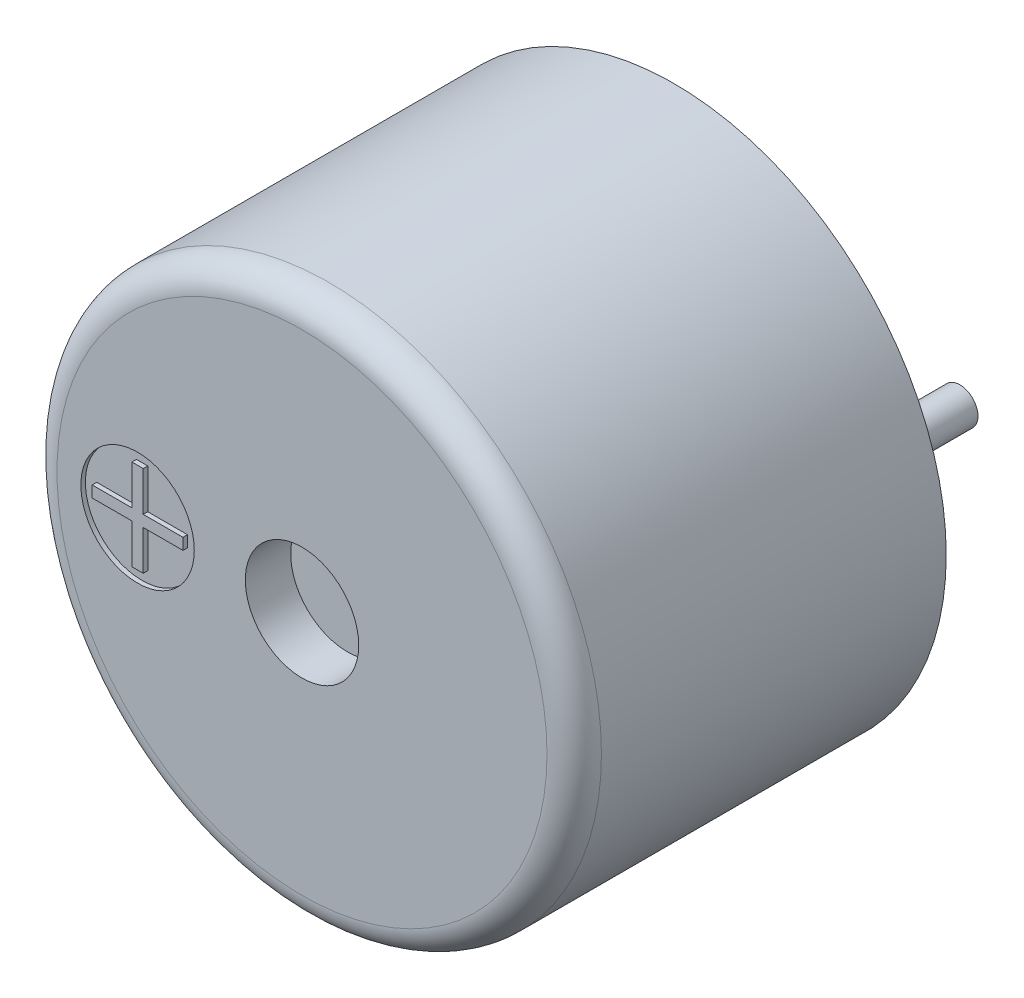
from build123d import *

# Parameters (mm, degrees)
ESQUISSE1_R    = 6
CORP_DEPTH     = 8.2
ESQUISSE2_R    = 1.25
TROU_SON_DEPTH = 1
ESQUISSE3_R    = 0.4
PINS_DEPTH     = 3
CONG_1_R       = 0.6
ESQUISSE4_R    = 1.25
PLUS_DEPTH     = 0.1


with BuildPart() as part:
    # Esquisse1 → corp (new body)
    with BuildSketch(Plane.XY):
        Circle(ESQUISSE1_R)
    extrude(amount=CORP_DEPTH)

    # Esquisse2 → trou son (cut)
    with BuildSketch(Plane.XY.offset(8.2)):
        Circle(ESQUISSE2_R)
    extrude(amount=-TROU_SON_DEPTH, mode=Mode.SUBTRACT)

    # Esquisse3 → pins (add)
    with BuildSketch(Plane.XY):
        with Locations((3.3, 0)):
            Circle(ESQUISSE3_R)
        with Locations(Location((-3.3, 0, 0), (0, 0, 180))):
            Circle(ESQUISSE3_R)
    extrude(amount=-PINS_DEPTH)

    # Congé1
    cong_1_edges = [part.edges().sort_by_distance(p)[0] for p in [
        (-6, 0, 8.2),
    ]]
    fillet(cong_1_edges, radius=CONG_1_R)

    # Esquisse4 → plus (cut)
    with BuildSketch(Plane.XY.offset(8.2)):
        with Locations((-3.625, 0)):
            Circle(ESQUISSE4_R)
        Polygon((-2.625, -0.125), (-2.625, 0.125), (-3.5, 0.125), (-3.5, 1), (-3.75, 1), (-3.75, 0.125), (-4.625, 0.125), (-4.625, -0.125), (-3.75, -0.125), (-3.75, -1), (-3.5, -1), (-3.5, -0.125), align=None, mode=Mode.SUBTRACT)
    extrude(amount=-PLUS_DEPTH, mode=Mode.SUBTRACT)


solid = part.part
